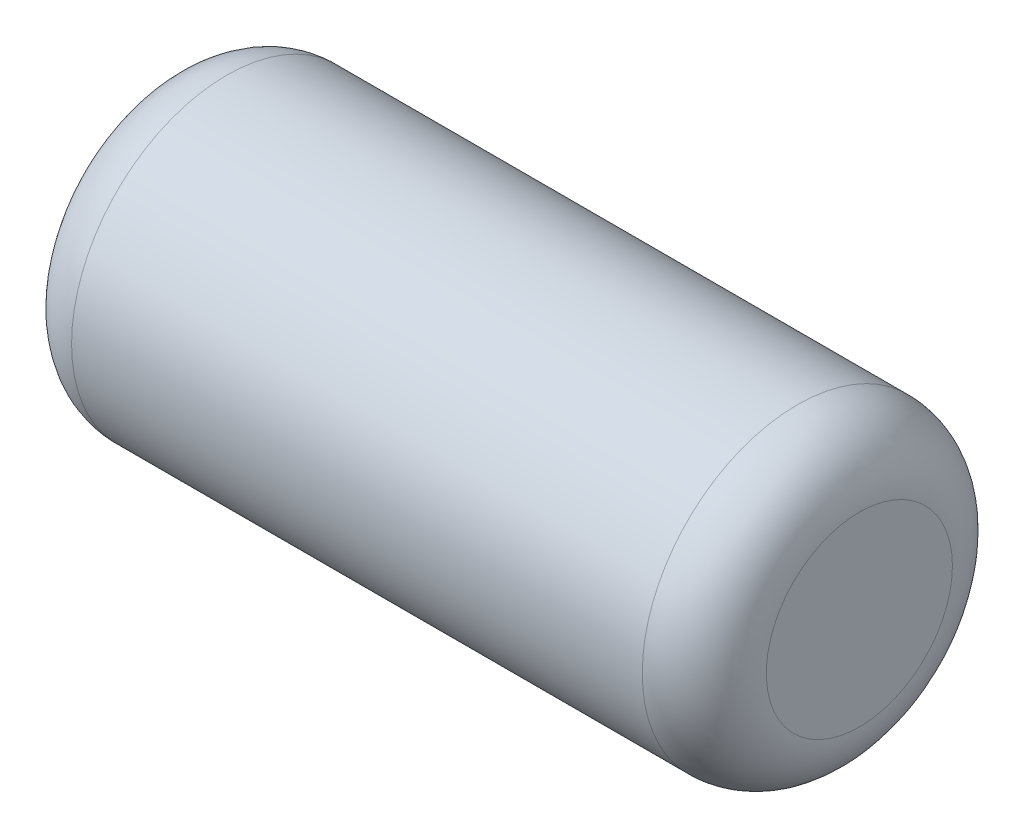
from build123d import *

# Parameters (mm, degrees)
SKETCH1_R           = 63.5
BOSS_EXTRUDE1_DEPTH = 284.48
FILLET1_R           = 25.4


with BuildPart() as part:
    # Sketch1 → Boss-Extrude1 (new body)
    with BuildSketch(Plane(origin=(0, 0, 0), x_dir=(0, 0, -1), z_dir=(1, 0, 0))):
        Circle(SKETCH1_R)
    extrude(amount=BOSS_EXTRUDE1_DEPTH)

    # Fillet1
    fillet1_edges = [part.edges().sort_by_distance(p)[0] for p in [
        (0, 0, 63.5),
        (284.48, 0, 63.5),
    ]]
    fillet(fillet1_edges, radius=FILLET1_R)


solid = part.part
